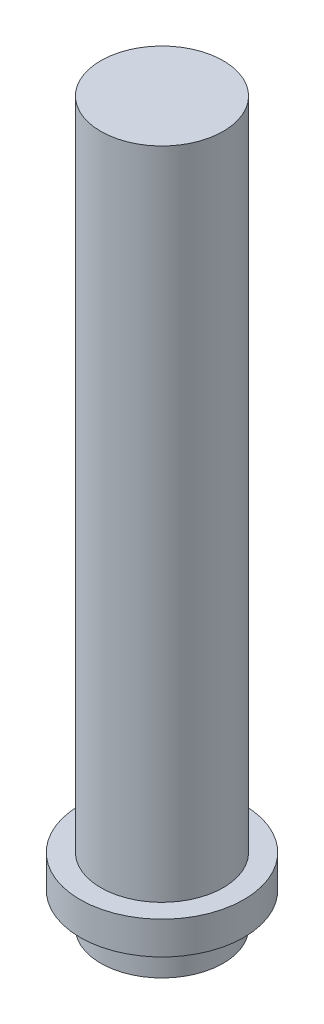
from build123d import *

# Parameters (mm, degrees)
SKETCH1_R           = 6.35
BOSS_EXTRUDE1_DEPTH = 2.54
SKETCH2_R           = 4.7498
BOSS_EXTRUDE2_DEPTH = 50.8
BOSS_EXTRUDE3_START = 2.54
SKETCH3_R           = 4.7498
BOSS_EXTRUDE3_DEPTH = 2.54


with BuildPart() as part:
    # Sketch1 → Boss-Extrude1 (new body)
    with BuildSketch(Plane(origin=(0, 0, 0), x_dir=(1, 0, 0), z_dir=(0, 1, 0))):
        with Locations(Location((0, 0, 0), (0, 0, 270))):
            Circle(SKETCH1_R)
    extrude(amount=BOSS_EXTRUDE1_DEPTH)

    # Sketch2 → Boss-Extrude2 (add)
    with BuildSketch(Plane(origin=(0, 2.54, 0), x_dir=(1, 0, 0), z_dir=(0, 1, 0))):
        with Locations(Location((0, 0, 0), (0, 0, 270))):
            Circle(SKETCH2_R)
    extrude(amount=BOSS_EXTRUDE2_DEPTH)

    # Sketch3 → Boss-Extrude3 (add)
    with BuildSketch(Plane.XZ.offset(BOSS_EXTRUDE3_START)):
        with Locations(Location((0, 0, 0), (0, 0, 90))):
            Circle(SKETCH3_R)
    extrude(amount=-BOSS_EXTRUDE3_DEPTH)


solid = part.part
